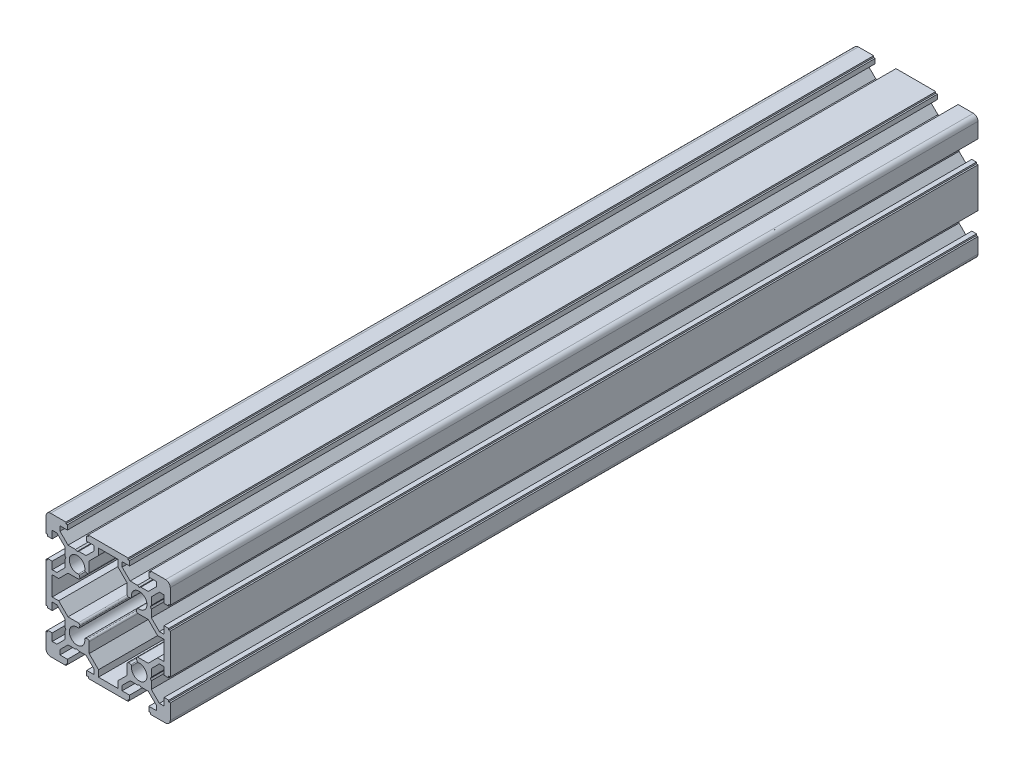
from build123d import *

# Parameters (mm, degrees)
EXTRUDE_1_DEPTH = 260


with BuildPart() as part:
    # 草图29 → 凸台-拉伸1 (new body)
    with BuildSketch(Plane.XY):
        with BuildLine():
            Line((0.519615242, -3.9), (2.910050506, -3.9))
            Line((2.910050506, -3.9), (5.5, -6.489949494))
            Line((5.5, -6.489949494), (5.5, -8))
            Line((5.5, -8), (3.1, -8))
            Line((3.1, -8), (3.1, -9.5))
            Line((3.1, -9.5), (3.6, -9.5))
            Line((3.6, -9.5), (3.6, -10))
            Line((3.6, -10), (16.4, -10))
            Line((16.4, -10), (16.4, -9.5))
            Line((16.4, -9.5), (16.9, -9.5))
            Line((16.9, -9.5), (16.9, -8))
            Line((16.9, -8), (14.5, -8))
            Line((14.5, -8), (14.5, -6.489949494))
            Line((14.5, -6.489949494), (17.089949494, -3.9))
            Line((17.089949494, -3.9), (19.480384758, -3.9))
            Line((19.480384758, -3.9), (20, -3.6))
            Line((20, -3.6), (20.519615242, -3.9))
            Line((20.519615242, -3.9), (22.910050506, -3.9))
            Line((22.910050506, -3.9), (25.5, -6.489949494))
            Line((25.5, -6.489949494), (25.5, -8))
            Line((25.5, -8), (23.1, -8))
            Line((23.1, -8), (23.1, -9.5))
            Line((23.1, -9.5), (23.6, -9.5))
            Line((23.6, -9.5), (23.6, -10))
            Line((23.6, -10), (28.5, -10))
            ThreePointArc((28.5, -10), (29.560660172, -9.560660172), (30, -8.5))
            Line((30, -8.5), (30, -3.6))
            Line((30, -3.6), (29.5, -3.6))
            Line((29.5, -3.6), (29.5, -3.1))
            Line((29.5, -3.1), (28, -3.1))
            Line((28, -3.1), (28, -5.5))
            Line((28, -5.5), (26.489949494, -5.5))
            Line((26.489949494, -5.5), (23.9, -2.910050506))
            Line((23.9, -2.910050506), (23.9, -0.519615242))
            Line((23.9, -0.519615242), (23.6, 0))
            Line((23.6, 0), (23.9, 0.519615242))
            Line((23.9, 0.519615242), (23.9, 2.910050506))
            Line((23.9, 2.910050506), (26.489949494, 5.5))
            Line((26.489949494, 5.5), (28, 5.5))
            Line((28, 5.5), (28, 3.1))
            Line((28, 3.1), (29.5, 3.1))
            Line((29.5, 3.1), (29.5, 3.6))
            Line((29.5, 3.6), (30, 3.6))
            Line((30, 3.6), (30, 16.4))
            Line((30, 16.4), (29.5, 16.4))
            Line((29.5, 16.4), (29.5, 16.9))
            Line((29.5, 16.9), (28, 16.9))
            Line((28, 16.9), (28, 14.5))
            Line((28, 14.5), (26.489949494, 14.5))
            Line((26.489949494, 14.5), (23.9, 17.089949494))
            Line((23.9, 17.089949494), (23.9, 19.480384758))
            Line((23.9, 19.480384758), (23.6, 20))
            Line((23.6, 20), (23.9, 20.519615242))
            Line((23.9, 20.519615242), (23.9, 22.910050506))
            Line((23.9, 22.910050506), (26.489949494, 25.5))
            Line((26.489949494, 25.5), (28, 25.5))
            Line((28, 25.5), (28, 23.1))
            Line((28, 23.1), (29.5, 23.1))
            Line((29.5, 23.1), (29.5, 23.6))
            Line((29.5, 23.6), (30, 23.6))
            Line((30, 23.6), (30, 28.5))
            ThreePointArc((30, 28.5), (29.560660172, 29.560660172), (28.5, 30))
            Line((28.5, 30), (23.6, 30))
            Line((23.6, 30), (23.6, 29.5))
            Line((23.6, 29.5), (23.1, 29.5))
            Line((23.1, 29.5), (23.1, 28))
            Line((23.1, 28), (25.5, 28))
            Line((25.5, 28), (25.5, 26.489949494))
            Line((25.5, 26.489949494), (22.910050506, 23.9))
            Line((22.910050506, 23.9), (20.519615242, 23.9))
            Line((20.519615242, 23.9), (20, 23.6))
            Line((20, 23.6), (19.480384758, 23.9))
            Line((19.480384758, 23.9), (17.089949494, 23.9))
            Line((17.089949494, 23.9), (14.5, 26.489949494))
            Line((14.5, 26.489949494), (14.5, 28))
            Line((14.5, 28), (16.9, 28))
            Line((16.9, 28), (16.9, 29.5))
            Line((16.9, 29.5), (16.4, 29.5))
            Line((16.4, 29.5), (16.4, 30))
            Line((16.4, 30), (3.6, 30))
            Line((3.6, 30), (3.6, 29.5))
            Line((3.6, 29.5), (3.1, 29.5))
            Line((3.1, 29.5), (3.1, 28))
            Line((3.1, 28), (5.5, 28))
            Line((5.5, 28), (5.5, 26.489949494))
            Line((5.5, 26.489949494), (2.910050506, 23.9))
            Line((2.910050506, 23.9), (0.519615242, 23.9))
            Line((0.519615242, 23.9), (0, 23.6))
            Line((0, 23.6), (-0.519615242, 23.9))
            Line((-0.519615242, 23.9), (-2.910050506, 23.9))
            Line((-2.910050506, 23.9), (-5.5, 26.489949494))
            Line((-5.5, 26.489949494), (-5.5, 28))
            Line((-5.5, 28), (-3.1, 28))
            Line((-3.1, 28), (-3.1, 29.5))
            Line((-3.1, 29.5), (-3.6, 29.5))
            Line((-3.6, 29.5), (-3.6, 30))
            Line((-3.6, 30), (-8.5, 30))
            ThreePointArc((-8.5, 30), (-9.560660172, 29.560660172), (-10, 28.5))
            Line((-10, 28.5), (-10, 23.6))
            Line((-10, 23.6), (-9.5, 23.6))
            Line((-9.5, 23.6), (-9.5, 23.1))
            Line((-9.5, 23.1), (-8, 23.1))
            Line((-8, 23.1), (-8, 25.5))
            Line((-8, 25.5), (-6.489949494, 25.5))
            Line((-6.489949494, 25.5), (-3.9, 22.910050506))
            Line((-3.9, 22.910050506), (-3.9, 20.519615242))
            Line((-3.9, 20.519615242), (-3.6, 20))
            Line((-3.6, 20), (-3.9, 19.480384758))
            Line((-3.9, 19.480384758), (-3.9, 17.089949494))
            Line((-3.9, 17.089949494), (-6.489949494, 14.5))
            Line((-6.489949494, 14.5), (-8, 14.5))
            Line((-8, 14.5), (-8, 16.9))
            Line((-8, 16.9), (-9.5, 16.9))
            Line((-9.5, 16.9), (-9.5, 16.4))
            Line((-9.5, 16.4), (-10, 16.4))
            Line((-10, 16.4), (-10, 3.6))
            Line((-10, 3.6), (-9.5, 3.6))
            Line((-9.5, 3.6), (-9.5, 3.1))
            Line((-9.5, 3.1), (-8, 3.1))
            Line((-8, 3.1), (-8, 5.5))
            Line((-8, 5.5), (-6.489949494, 5.5))
            Line((-6.489949494, 5.5), (-3.9, 2.910050506))
            Line((-3.9, 2.910050506), (-3.9, 0.519615242))
            Line((-3.9, 0.519615242), (-3.6, 0))
            Line((-3.6, 0), (-3.9, -0.519615242))
            Line((-3.9, -0.519615242), (-3.9, -2.910050506))
            Line((-3.9, -2.910050506), (-6.489949494, -5.5))
            Line((-6.489949494, -5.5), (-8, -5.5))
            Line((-8, -5.5), (-8, -3.1))
            Line((-8, -3.1), (-9.5, -3.1))
            Line((-9.5, -3.1), (-9.5, -3.6))
            Line((-9.5, -3.6), (-10, -3.6))
            Line((-10, -3.6), (-10, -8.5))
            ThreePointArc((-10, -8.5), (-9.560660172, -9.560660172), (-8.5, -10))
            Line((-8.5, -10), (-3.6, -10))
            Line((-3.6, -10), (-3.6, -9.5))
            Line((-3.6, -9.5), (-3.1, -9.5))
            Line((-3.1, -9.5), (-3.1, -8))
            Line((-3.1, -8), (-5.5, -8))
            Line((-5.5, -8), (-5.5, -6.489949494))
            Line((-5.5, -6.489949494), (-2.910050506, -3.9))
            Line((-2.910050506, -3.9), (-0.519615242, -3.9))
            Line((-0.519615242, -3.9), (0, -3.6))
            Line((0, -3.6), (0.519615242, -3.9))
        make_face()
        with BuildLine():
            Line((28, 6.9), (25.910050506, 6.9))
            Line((25.910050506, 6.9), (22.910050506, 3.9))
            Line((22.910050506, 3.9), (19.606610836, 3.9))
            ThreePointArc((19.606610836, 3.9), (19.209934166, 3.704380715), (19.123647923, 3.270590477))
            Line((19.123647923, 3.270590477), (19.279478272, 2.689023696))
            ThreePointArc((19.279478272, 2.689023696), (19.405533701, 2.515283248), (19.615407161, 2.470240545))
            ThreePointArc((19.615407161, 2.470240545), (21.767766953, -1.767766953), (17.529759455, 0.384592839))
            ThreePointArc((17.529759455, 0.384592839), (17.484716752, 0.594466299), (17.310976304, 0.720521728))
            Line((17.310976304, 0.720521728), (16.729409523, 0.876352077))
            ThreePointArc((16.729409523, 0.876352077), (16.295619285, 0.790065834), (16.1, 0.393389164))
            Line((16.1, 0.393389164), (16.1, -2.910050506))
            Line((16.1, -2.910050506), (13.1, -5.910050506))
            Line((13.1, -5.910050506), (13.1, -8))
            Line((13.1, -8), (6.9, -8))
            Line((6.9, -8), (6.9, -5.910050506))
            Line((6.9, -5.910050506), (3.9, -2.910050506))
            Line((3.9, -2.910050506), (3.9, 0.393389164))
            ThreePointArc((3.9, 0.393389164), (3.704380715, 0.790065834), (3.270590477, 0.876352077))
            Line((3.270590477, 0.876352077), (2.689023696, 0.720521728))
            ThreePointArc((2.689023696, 0.720521728), (2.515283248, 0.594466299), (2.470240545, 0.384592839))
            ThreePointArc((2.470240545, 0.384592839), (-1.767766953, -1.767766953), (0.384592839, 2.470240545))
            ThreePointArc((0.384592839, 2.470240545), (0.594466299, 2.515283248), (0.720521728, 2.689023696))
            Line((0.720521728, 2.689023696), (0.876352077, 3.270590477))
            ThreePointArc((0.876352077, 3.270590477), (0.790065834, 3.704380715), (0.393389164, 3.9))
            Line((0.393389164, 3.9), (-2.910050506, 3.9))
            Line((-2.910050506, 3.9), (-5.910050506, 6.9))
            Line((-5.910050506, 6.9), (-8, 6.9))
            Line((-8, 6.9), (-8, 13.1))
            Line((-8, 13.1), (-5.910050506, 13.1))
            Line((-5.910050506, 13.1), (-2.910050506, 16.1))
            Line((-2.910050506, 16.1), (0.393389164, 16.1))
            ThreePointArc((0.393389164, 16.1), (0.790065834, 16.295619285), (0.876352077, 16.729409523))
            Line((0.876352077, 16.729409523), (0.720521728, 17.310976304))
            ThreePointArc((0.720521728, 17.310976304), (0.594466299, 17.484716752), (0.384592839, 17.529759455))
            ThreePointArc((0.384592839, 17.529759455), (-1.767766953, 21.767766953), (2.470240545, 19.615407161))
            ThreePointArc((2.470240545, 19.615407161), (2.515283248, 19.405533701), (2.689023696, 19.279478272))
            Line((2.689023696, 19.279478272), (3.270590477, 19.123647923))
            ThreePointArc((3.270590477, 19.123647923), (3.704380715, 19.209934166), (3.9, 19.606610836))
            Line((3.9, 19.606610836), (3.9, 22.910050506))
            Line((3.9, 22.910050506), (6.9, 25.910050506))
            Line((6.9, 25.910050506), (6.9, 28))
            Line((6.9, 28), (13.1, 28))
            Line((13.1, 28), (13.1, 25.910050506))
            Line((13.1, 25.910050506), (16.1, 22.910050506))
            Line((16.1, 22.910050506), (16.1, 19.606610836))
            ThreePointArc((16.1, 19.606610836), (16.295619285, 19.209934166), (16.729409523, 19.123647923))
            Line((16.729409523, 19.123647923), (17.310976304, 19.279478272))
            ThreePointArc((17.310976304, 19.279478272), (17.484716752, 19.405533701), (17.529759455, 19.615407161))
            ThreePointArc((17.529759455, 19.615407161), (21.767766953, 21.767766953), (19.615407161, 17.529759455))
            ThreePointArc((19.615407161, 17.529759455), (19.405533701, 17.484716752), (19.279478272, 17.310976304))
            Line((19.279478272, 17.310976304), (19.123647923, 16.729409523))
            ThreePointArc((19.123647923, 16.729409523), (19.209934166, 16.295619285), (19.606610836, 16.1))
            Line((19.606610836, 16.1), (22.910050506, 16.1))
            Line((22.910050506, 16.1), (25.910050506, 13.1))
            Line((25.910050506, 13.1), (28, 13.1))
            Line((28, 13.1), (28, 6.9))
        make_face(mode=Mode.SUBTRACT)
    extrude(amount=EXTRUDE_1_DEPTH)


solid = part.part
